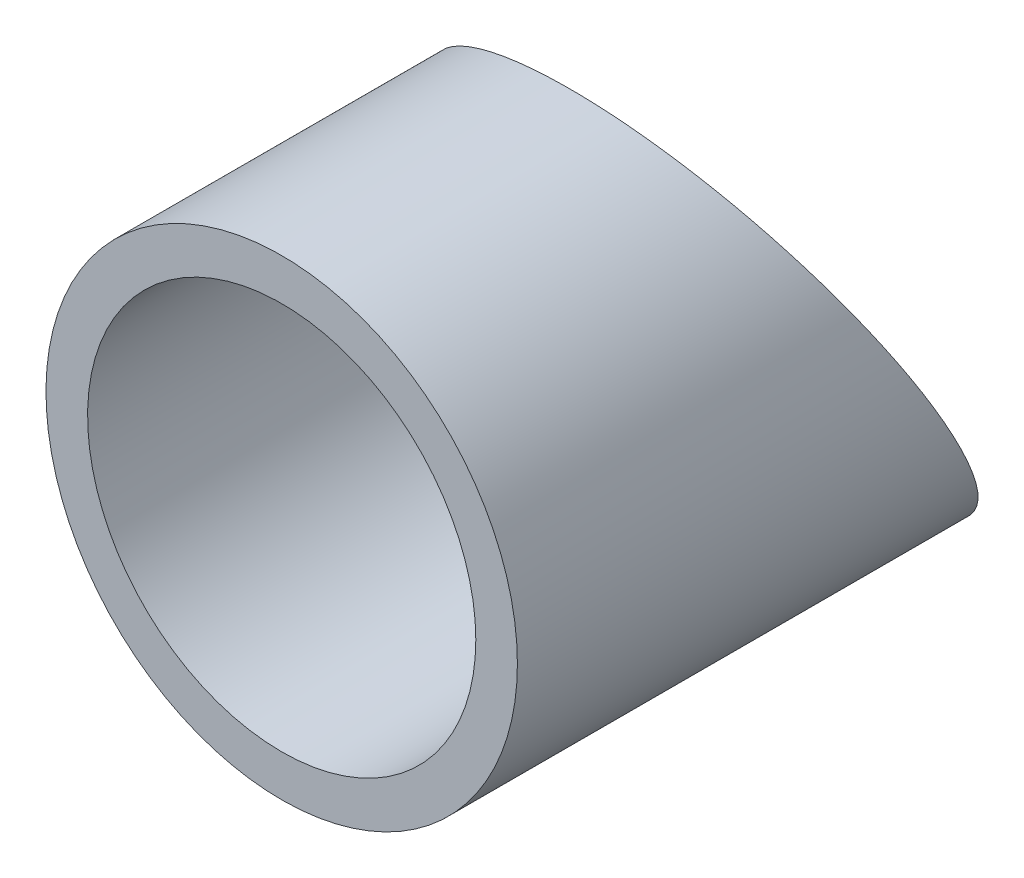
from build123d import *

# Parameters (mm, degrees)
SKETCH1_R               = 17
SKETCH1_R_2             = 14
BOSS_EXTRUDE1_DEPTH     = 40
CUT_EXTRUDE1_DEPTH      = 47.669047558
CUT_EXTRUDE1_DEPTH_BACK = 47.669047558


with BuildPart() as part:
    # Sketch1 → Boss-Extrude1 (new body)
    with BuildSketch(Plane.XY):
        Circle(SKETCH1_R)
        Circle(SKETCH1_R_2, mode=Mode.SUBTRACT)
    extrude(amount=BOSS_EXTRUDE1_DEPTH)

    # Sketch2 → Cut-Extrude1 (cut, two sides: drawn at the far end of the back side and taken through both)
    with BuildSketch(Plane(origin=(0, 0, 0), x_dir=(0, 0, -1), z_dir=(1, 0, 0)).offset(-CUT_EXTRUDE1_DEPTH_BACK)):
        Polygon((-34.229163371, 43.061181139), (13.703241918, -40.063238301), (34.25715955, -28.211140965), (-13.675245739, 54.913278475), align=None)
    extrude(amount=CUT_EXTRUDE1_DEPTH + CUT_EXTRUDE1_DEPTH_BACK, mode=Mode.SUBTRACT)


solid = part.part
